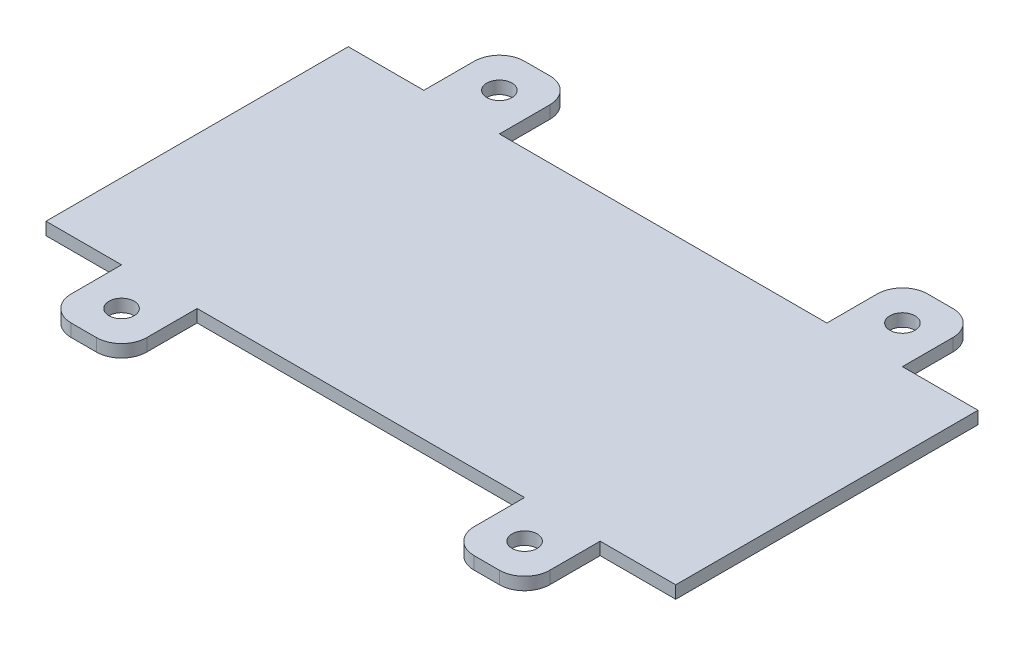
from build123d import *

# Parameters (mm, degrees)
SKETCH_1_W      = 250
SKETCH_1_H      = 120
EXTRUDE_1_DEPTH = 5
SKETCH_2_W      = 30
SKETCH_2_H      = 30
SKETCH_2_R      = 5
EXTRUDE_2_DEPTH = 5
FILLET_1_R      = 10


with BuildPart() as part:
    # Эскиз1 → Бобышка-Вытянуть1 (new body)
    with BuildSketch(Plane(origin=(0, 0, 0), x_dir=(1, 0, 0), z_dir=(0, 1, 0))):
        Rectangle(SKETCH_1_W, SKETCH_1_H)
    extrude(amount=EXTRUDE_1_DEPTH)


with BuildPart() as body_2:
    # Эскиз2 → Бобышка-Вытянуть2 (new body)
    with BuildSketch(Plane(origin=(0, 0, 0), x_dir=(1, 0, 0), z_dir=(0, 1, 0))):
        with Locations((-80, 75)):
            Rectangle(SKETCH_2_W, SKETCH_2_H)
        with Locations(Location((-80, 75, 0), (0, 0, 270))):
            Circle(SKETCH_2_R, mode=Mode.SUBTRACT)
    extrude(amount=EXTRUDE_2_DEPTH)

    # Скругление1
    fillet_1_edges = [body_2.edges().sort_by_distance(p)[0] for p in [
        (-95, 2.5, -90),
        (-65, 2.5, -90),
    ]]
    fillet(fillet_1_edges, radius=FILLET_1_R)


with BuildPart() as body_3:
    # Зеркальное отражение1: mirrored copy
    add(body_2.part.mirror(Plane(origin=(0, 0, 0), x_dir=(0, 0, 1), z_dir=(1, 0, 0))))


with BuildPart() as body_4:
    # Зеркальное отражение3: mirrored copy
    add(body_2.part.mirror(Plane.XY))


with BuildPart() as body_5:
    # Mirror 3 2: mirrored copy
    add(body_3.part.mirror(Plane.XY))


with BuildPart() as part_1:
    add(part.part)

    # Combine 1: union body 4, body 3, body 2, body 5
    add(body_4.part)
    add(body_3.part)
    add(body_2.part)
    add(body_5.part)


solid = part_1.part
